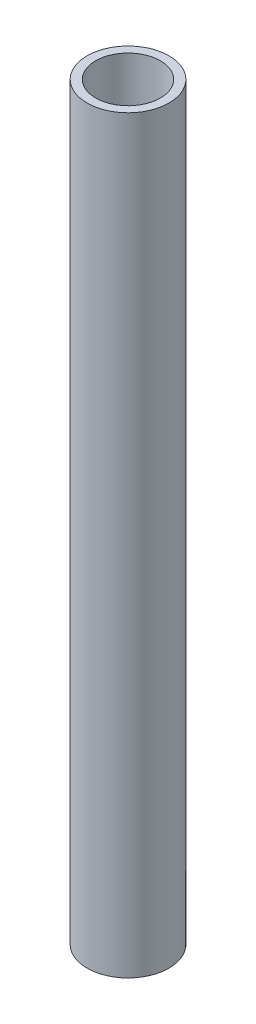
from build123d import *

# Parameters (mm, degrees)
SKETCH1_R           = 16.65
SKETCH1_R_2         = 13.15
BOSS_EXTRUDE1_DEPTH = 304.8


with BuildPart() as part:
    # Sketch1 → Boss-Extrude1 (new body)
    with BuildSketch(Plane(origin=(0, 0, 0), x_dir=(1, 0, 0), z_dir=(0, 1, 0))):
        with Locations(Location((0, 0, 0), (0, 0, 90))):
            Circle(SKETCH1_R)
        with Locations(Location((0, 0, 0), (0, 0, 90))):
            Circle(SKETCH1_R_2, mode=Mode.SUBTRACT)
    extrude(amount=BOSS_EXTRUDE1_DEPTH)


solid = part.part
